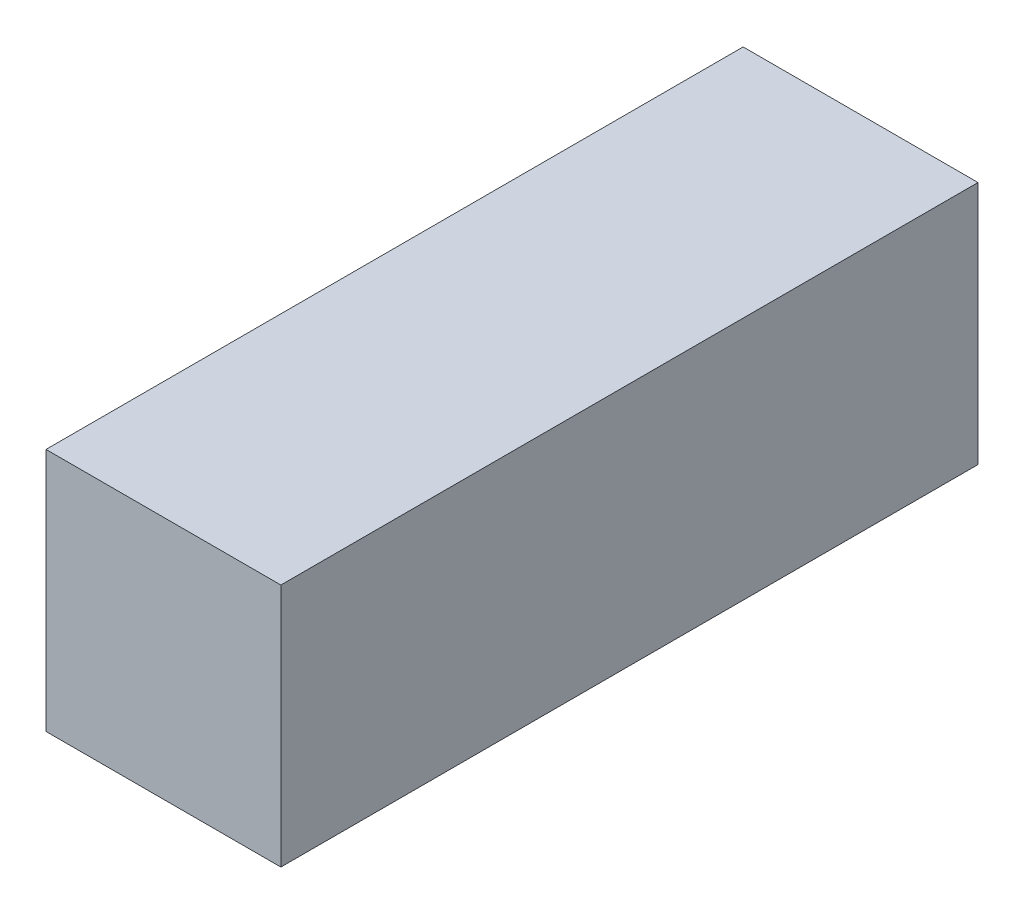
from build123d import *

# Parameters (mm, degrees)
SKETCH3_W           = 1026.824977428
SKETCH3_H           = 1068.062223586
BOSS_EXTRUDE2_DEPTH = 3048


with BuildPart() as part:
    # Sketch2 → Revolve1 (revolve)
    with BuildSketch(Plane(origin=(0, 0, 0), x_dir=(0, 0, -1), z_dir=(1, 0, 0))):
        with BuildLine():
            Line((-1371.6, 0), (1371.6, 0))
            add(Edge.make_bspline(
                [(0, 457.2), (754.172424681, 374.058740476), (1371.6, 0)],
                knots=[0, 0, 0, 0.947101695, 0.947101695, 0.947101695], degree=2))
            add(Edge.make_bspline(
                [(-1371.6, 0), (-1157.286468217, 494.854511367), (-443.029223323, 487.528566422), (0, 457.2)],
                knots=[0, 0, 0, 0, 1, 1, 1, 1], degree=3))
        make_face()
    revolve(axis=Axis((0, 0, 1371.6), (0, 0, -1)))


with BuildPart() as body_2:
    # Sketch3 → Boss-Extrude2 (new body)
    with BuildSketch(Plane.XY.offset(1460)):
        Rectangle(SKETCH3_W, SKETCH3_H)
    extrude(amount=-BOSS_EXTRUDE2_DEPTH)

    # Combine1: cut part
    add(part.part, mode=Mode.SUBTRACT)


solid = body_2.part
